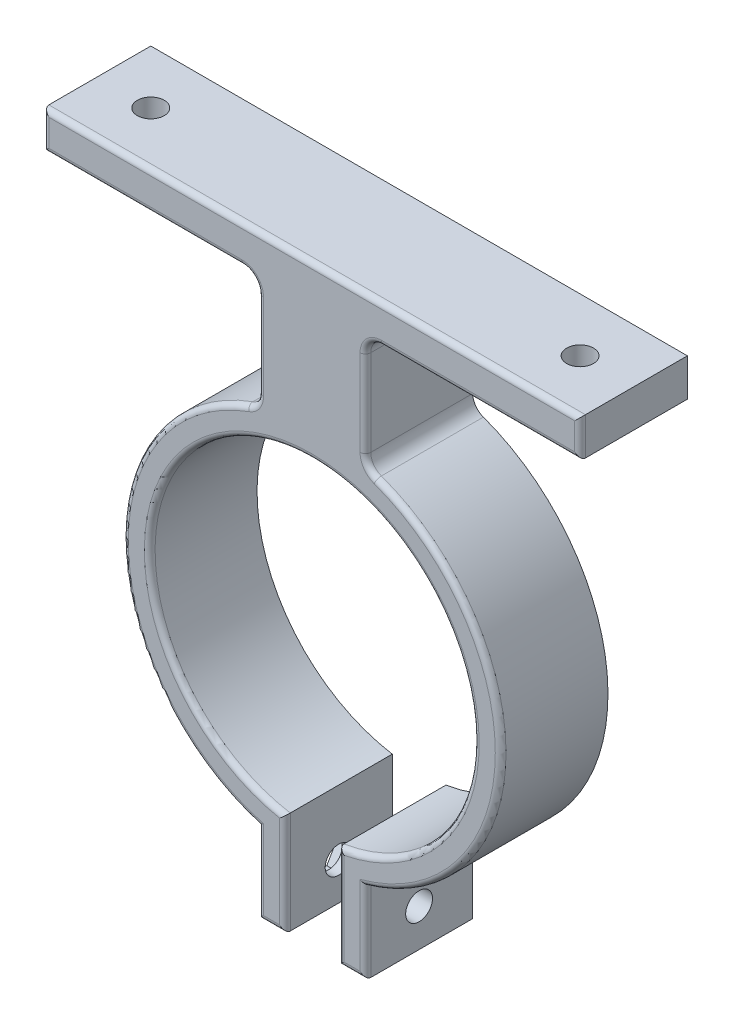
from build123d import *

# Parameters (mm, degrees)
BOSS_EXTRUDE1_DEPTH = 20
FILLET1_R           = 3
SKETCH2_R           = 2.5
CUT_EXTRUDE1_DEPTH  = 117.967247128
SKETCH3_R           = 2.5
CUT_EXTRUDE2_DEPTH  = 89.566359302
SKETCH3_4_R         = 2.5
CUT_EXTRUDE3_DEPTH  = 3.175
FILLET2_R           = 1


with BuildPart() as part:
    # Sketch1 → Boss-Extrude1 (new body)
    with BuildSketch(Plane.XY):
        with BuildLine():
            ThreePointArc((-5, -29.78321675), (0, 30.2), (5, -29.78321675))
            Line((5, -29.78321675), (5, -48.83321675))
            Line((5, -48.83321675), (10, -48.83321675))
            Line((10, -48.83321675), (10, -33.749666665))
            ThreePointArc((10, -33.749666665), (35.2, 0), (10, 33.749666665))
            Line((10, 33.749666665), (10, 55))
            Line((10, 55), (50, 55))
            Line((50, 55), (50, 62))
            Line((50, 62), (-50, 62))
            Line((-50, 62), (-50, 55))
            Line((-50, 55), (-10, 55))
            Line((-10, 55), (-10, 33.749666665))
            ThreePointArc((-10, 33.749666665), (-35.2, 0), (-10, -33.749666665))
            Line((-10, -33.749666665), (-10, -48.83321675))
            Line((-10, -48.83321675), (-5, -48.83321675))
            Line((-5, -48.83321675), (-5, -29.78321675))
        make_face()
    extrude(amount=BOSS_EXTRUDE1_DEPTH)

    # Fillet1
    fillet1_edges = [part.edges().sort_by_distance(p)[0] for p in [
        (10, 33.749666665, 10),
        (10, 55, 10),
        (-10, 33.749666665, 10),
        (-10, 55, 10),
    ]]
    fillet(fillet1_edges, radius=FILLET1_R)

    # Sketch2 → Cut-Extrude1 (cut, through all)
    with BuildSketch(Plane(origin=(0, 55, 0), x_dir=(-1, 0, 0), z_dir=(0, -1, 0))):
        with Locations((40, -10)):
            Circle(SKETCH2_R)
        with Locations((-40, -10)):
            Circle(SKETCH2_R)
    extrude(amount=-CUT_EXTRUDE1_DEPTH, mode=Mode.SUBTRACT)

    # Sketch3 → Cut-Extrude2 (cut, through all)
    with BuildSketch(Plane.ZY.offset(10)):
        with Locations((10, -41.83321675)):
            Circle(SKETCH3_R)
    extrude(amount=-CUT_EXTRUDE2_DEPTH, mode=Mode.SUBTRACT)

    # Sketch3<4> → Cut-Extrude3 (cut)
    with BuildSketch(Plane.ZY.offset(10)):
        Polygon((15.600297611, -41.83321675), (12.800148806, -36.98321675), (7.199851194, -36.98321675), (4.399702389, -41.83321675), (7.199851194, -46.68321675), (12.800148806, -46.68321675), align=None)
        with Locations((10, -41.83321675)):
            Circle(SKETCH3_4_R, mode=Mode.SUBTRACT)
    extrude(amount=-CUT_EXTRUDE3_DEPTH, mode=Mode.SUBTRACT)

    # Fillet2
    fillet2_edges = [part.edges().sort_by_distance(p)[0] for p in [
        (-50, 58.5, 20),
        (0, 62, 20),
        (50, 58.5, 20),
        (31.5, 55, 20),
        (10.878679656, 54.121320344, 20),
        (10, 43.959955457, 20),
        (10.544106352, 34.196952298, 20),
        (35.184584451, -1.041641486, 20),
        (10, -41.291441708, 20),
        (7.5, -48.83321675, 20),
        (5, -39.30821675, 20),
        (0, 30.2, 20),
        (-5, -39.30821675, 20),
        (-7.5, -48.83321675, 20),
        (-10, -41.291441708, 20),
        (-35.184584451, -1.041641486, 20),
        (-10.544106352, 34.196952298, 20),
        (-10, 43.959955457, 20),
        (-10.878679656, 54.121320344, 20),
        (-31.5, 55, 20),
    ]]
    fillet(fillet2_edges, radius=FILLET2_R)


solid = part.part
